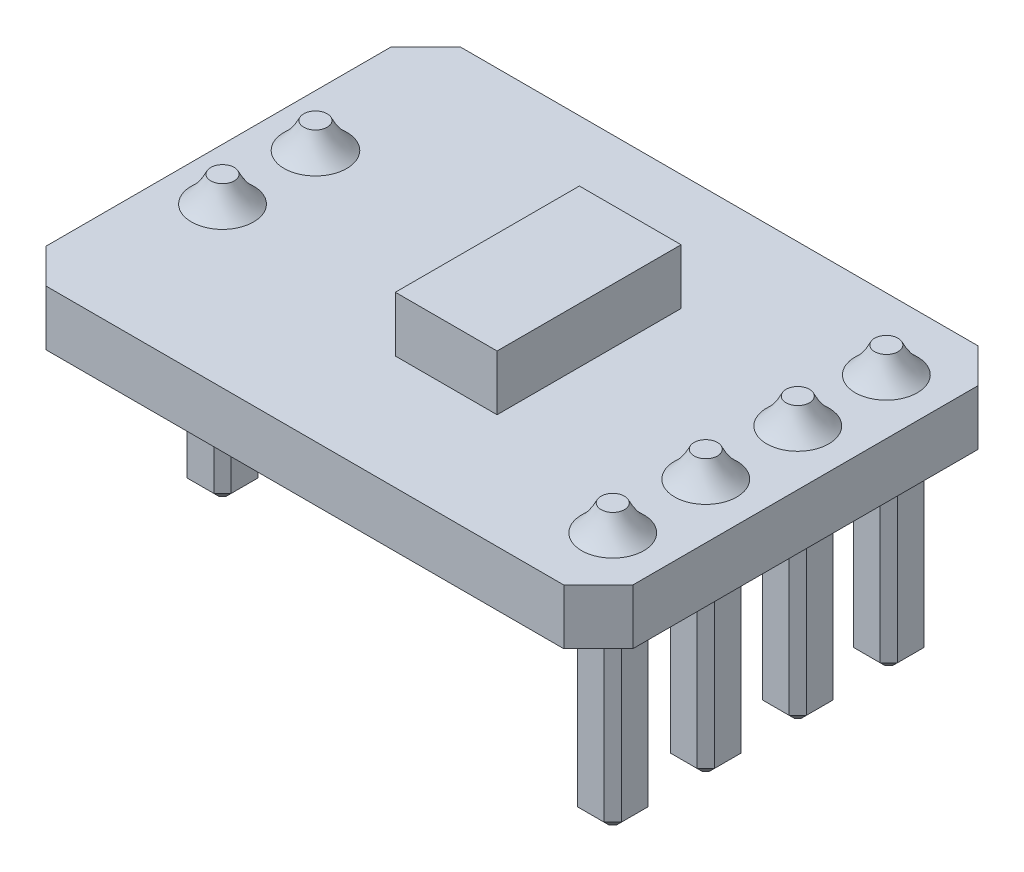
from build123d import *

# Parameters (mm, degrees)
SKETCH1_W           = 17
SKETCH1_H           = 12
BOSS_EXTRUDE1_DEPTH = 1.6
SKETCH3_W           = 2.946551977
SKETCH3_H           = 5.331132701
BOSS_EXTRUDE2_DEPTH = 1.6
SKETCH10_W          = 1.272792206
SKETCH10_H          = 1.272792206
SKETCH10_H_2        = 1.272792207
BOSS_EXTRUDE3_DEPTH = 7
CHAMFER1_SIZE       = 0.25
SKETCH14_W          = 1.28426818
SKETCH14_H          = 1.28426818
SKETCH14_W_2        = 1.272792206
SKETCH14_H_2        = 1.272792206
BOSS_EXTRUDE4_DEPTH = 7
CHAMFER3_SIZE       = 0.25
FILLET1_R           = 0.1
CHAMFER4_SIZE       = 0.25
CHAMFER5_SIZE       = 1


with BuildPart() as part:
    # Sketch1 → Boss-Extrude1 (new body)
    with BuildSketch(Plane(origin=(0, 0, 0), x_dir=(1, 0, 0), z_dir=(0, 1, 0))):
        with Locations((8.5, 6)):
            Rectangle(SKETCH1_W, SKETCH1_H)
    extrude(amount=BOSS_EXTRUDE1_DEPTH)

    # Sketch3 → Boss-Extrude2 (add)
    with BuildSketch(Plane(origin=(0, 1.6, 0), x_dir=(1, 0, 0), z_dir=(0, 1, 0))):
        with Locations((9.289797438, 5.969623176)):
            Rectangle(SKETCH3_W, SKETCH3_H)
    extrude(amount=BOSS_EXTRUDE2_DEPTH)

    # Sketch5 → Revolve1 (revolve)
    with BuildSketch(Plane(origin=(15.4, 0, 0), x_dir=(0, 0, -1), z_dir=(1, 0, 0)), mode=Mode.PRIVATE) as revolve1_sk:
        with BuildLine():
            Line((2.018773021, 2.35), (2.357565231, 2.35))
            ThreePointArc((2.357565231, 2.35), (2.59682711, 1.944064718), (2.918773021, 1.6))
            Line((2.918773021, 1.6), (2.018773021, 1.6))
            Line((2.018773021, 1.6), (2.018773021, 2.35))
        make_face()
    revolve(revolve1_sk.sketch.rotate(Axis((15.4, 2.35, -2.018773021), (0, -1, 0)), 180), axis=Axis((15.4, 2.35, -2.018773021), (0, -1, 0)))

    # Sketch9 → Revolve4 (revolve)
    with BuildSketch(Plane(origin=(15.4, 0, 0), x_dir=(0, 0, -1), z_dir=(1, 0, 0)), mode=Mode.PRIVATE) as revolve4_sk:
        with BuildLine():
            Line((7.717859188, 2.35), (7.379066978, 2.35))
            Line((7.379066978, 2.35), (7.379066978, 1.6))
            Line((7.379066978, 1.6), (8.279066978, 1.6))
            ThreePointArc((8.279066978, 1.6), (7.957121066, 1.944064718), (7.717859188, 2.35))
        make_face()
    revolve(revolve4_sk.sketch.rotate(Axis((15.4, 1.6, -7.379066978), (0, -1, 0)), 180), axis=Axis((15.4, 1.6, -7.379066978), (0, -1, 0)))



with BuildPart() as body_2:
    # Sketch7 → Revolve3 (revolve)
    with BuildSketch(Plane(origin=(15.4, 0, 0), x_dir=(0, 0, -1), z_dir=(1, 0, 0)), mode=Mode.PRIVATE) as revolve3_sk:
        with BuildLine():
            Line((5.05205667, 2.35), (4.713264461, 2.35))
            Line((4.713264461, 2.35), (4.713264461, 1.6))
            Line((4.713264461, 1.6), (5.613264461, 1.6))
            ThreePointArc((5.613264461, 1.6), (5.291318549, 1.944064718), (5.05205667, 2.35))
        make_face()
    revolve(revolve3_sk.sketch.rotate(Axis((15.4, 1.6, -4.713264461), (0, -1, 0)), 180), axis=Axis((15.4, 1.6, -4.713264461), (0, -1, 0)))


with BuildPart() as part_1:
    add(part.part)

    add(body_2.part)  # Boss-Extrude3 merges body 2
    # Sketch10 → Boss-Extrude3 (add)
    with BuildSketch(Plane(origin=(0, 1.6, 0), x_dir=(1, 0, 0), z_dir=(0, 1, 0))):
        with Locations((15.4, 4.713264461)):
            Rectangle(SKETCH10_W, SKETCH10_H)
        with Locations((15.4, 2.018773021)):
            Rectangle(SKETCH10_W, SKETCH10_H_2)
        with Locations((15.4, 7.379066978)):
            Rectangle(SKETCH10_W, SKETCH10_H)
        with Locations((15.4, 10.015994476)):
            Rectangle(SKETCH10_W, SKETCH10_H)
    extrude(amount=-BOSS_EXTRUDE3_DEPTH)

    # Sketch11 → Revolve5 (revolve)
    with BuildSketch(Plane(origin=(15.4, 0, 0), x_dir=(0, 0, -1), z_dir=(1, 0, 0)), mode=Mode.PRIVATE) as revolve5_sk:
        with BuildLine():
            Line((10.283162216, 2.35), (9.944370006, 2.35))
            Line((9.944370006, 2.35), (9.944370006, 1.6))
            Line((9.944370006, 1.6), (10.844370006, 1.6))
            ThreePointArc((10.844370006, 1.6), (10.522424095, 1.944064718), (10.283162216, 2.35))
        make_face()
    revolve(revolve5_sk.sketch.rotate(Axis((15.4, 2.571627195, -9.944370006), (0, -1, 0)), 180), axis=Axis((15.4, 2.571627195, -9.944370006), (0, -1, 0)))

    # Chamfer1
    chamfer1_edges = [part_1.edges().sort_by_distance(p)[0] for p in [
        (16.036396103, -2.7, -5.349660564),
        (16.036396103, -2.7, -4.076868358),
        (14.763603897, -2.7, -4.076868358),
        (14.763603897, -2.7, -5.349660564),
        (16.036396103, -2.7, -2.655169125),
        (16.036396103, -2.7, -1.382376918),
        (14.763603897, -2.7, -1.382376918),
        (14.763603897, -2.7, -2.655169125),
        (16.036396103, -2.7, -8.015463081),
        (16.036396103, -2.7, -6.742670875),
        (14.763603897, -2.7, -6.742670875),
        (14.763603897, -2.7, -8.015463081),
        (16.036396103, -2.7, -10.652390579),
        (16.036396103, -2.7, -9.379598373),
        (14.763603897, -2.7, -9.379598373),
        (14.763603897, -2.7, -10.652390579),
    ]]
    chamfer(chamfer1_edges, length=CHAMFER1_SIZE)

    # Sketch12 → Revolve6 (revolve)
    with BuildSketch(Plane.ZY.offset(-1.5)):
        with BuildLine():
            Line((-6.967592244, 2.35), (-7.306384453, 2.35))
            Line((-7.306384453, 2.35), (-7.306384453, 1.6))
            Line((-7.306384453, 1.6), (-6.398269714, 1.6))
            ThreePointArc((-6.398269714, 1.6), (-6.7244939, 1.943449723), (-6.967592244, 2.35))
        make_face()
    revolve(axis=Axis((1.5, 2.71137522, -7.306384453), (0, -1, 0)))

    # Sketch13 → Revolve7 (revolve)
    with BuildSketch(Plane.ZY.offset(-1.5)):
        with BuildLine():
            Line((-4.274825865, 2.35), (-4.613618075, 2.35))
            Line((-4.613618075, 2.35), (-4.613618075, 1.6))
            Line((-4.613618075, 1.6), (-3.713618075, 1.6))
            ThreePointArc((-3.713618075, 1.6), (-4.035563986, 1.944064718), (-4.274825865, 2.35))
        make_face()
    revolve(axis=Axis((1.5, 2.718876296, -4.613618075), (0, -1, 0)))

    # Sketch14 → Boss-Extrude4 (add)
    with BuildSketch(Plane(origin=(0, 1.6, 0), x_dir=(1, 0, 0), z_dir=(0, 1, 0))):
        with Locations((1.5, 7.306384453)):
            Rectangle(SKETCH14_W, SKETCH14_H)
        with Locations((1.5, 4.613618075)):
            Rectangle(SKETCH14_W_2, SKETCH14_H_2)
    extrude(amount=-BOSS_EXTRUDE4_DEPTH)

    # Chamfer3
    chamfer3_edges = [part_1.edges().sort_by_distance(p)[0] for p in [
        (2.14213409, -2.7, -7.948518543),
        (2.14213409, -2.7, -6.664250363),
        (0.85786591, -2.7, -6.664250363),
        (0.85786591, -2.7, -7.948518543),
        (2.136396103, -2.7, -5.250014178),
        (2.136396103, -2.7, -3.977221972),
        (0.863603897, -2.7, -3.977221972),
        (0.863603897, -2.7, -5.250014178),
    ]]
    chamfer(chamfer3_edges, length=CHAMFER3_SIZE)

    # Fillet1
    fillet1_edges = [part_1.edges().sort_by_distance(p)[0] for p in [
        (15.4, 0, -9.379598373),
        (16.036396103, 0, -10.015994476),
        (14.763603897, 0, -10.015994476),
        (15.4, 0, -10.652390579),
        (15.4, 0, -6.742670875),
        (16.036396103, 0, -7.379066978),
        (14.763603897, 0, -7.379066978),
        (15.4, 0, -8.015463081),
        (14.763603897, 0, -4.713264461),
        (15.4, 0, -4.076868358),
        (15.4, 0, -5.349660564),
        (16.036396103, 0, -4.713264461),
        (15.4, 0, -1.382376918),
        (16.036396103, 0, -2.018773021),
        (14.763603897, 0, -2.018773021),
        (15.4, 0, -2.655169125),
        (15.911396103, 0, -9.504598373),
        (14.888603897, 0, -9.504598373),
        (14.888603897, 0, -10.527390579),
        (15.911396103, 0, -10.527390579),
        (15.911396103, 0, -6.867670875),
        (14.888603897, 0, -6.867670875),
        (14.888603897, 0, -7.890463081),
        (15.911396103, 0, -7.890463081),
        (14.888603897, 0, -4.201868358),
        (14.888603897, 0, -5.224660564),
        (15.911396103, 0, -4.201868358),
        (15.911396103, 0, -5.224660564),
        (15.911396103, 0, -1.507376918),
        (14.888603897, 0, -1.507376918),
        (14.888603897, 0, -2.530169125),
        (15.911396103, 0, -2.530169125),
        (0.85786591, 0, -7.306384453),
        (1.5, 0, -6.664250363),
        (1.5, 0, -7.948518543),
        (2.14213409, 0, -7.306384453),
        (0.863603897, 0, -4.613618075),
        (1.5, 0, -3.977221972),
        (1.5, 0, -5.250014178),
        (2.136396103, 0, -4.613618075),
        (0.98286591, 0, -6.789250363),
        (0.98286591, 0, -7.823518543),
        (2.01713409, 0, -7.823518543),
        (2.01713409, 0, -6.789250363),
        (0.988603897, 0, -4.102221972),
        (0.988603897, 0, -5.125014178),
        (2.011396103, 0, -5.125014178),
        (2.011396103, 0, -4.102221972),
    ]]
    fillet(fillet1_edges, radius=FILLET1_R)

    # Chamfer4
    chamfer4_edges = [part_1.edges().sort_by_distance(p)[0] for p in [
        (15.4, -5.4, -9.379598373),
        (16.036396103, -5.4, -10.015994476),
        (14.763603897, -5.4, -10.015994476),
        (15.4, -5.4, -10.652390579),
        (15.911396103, -5.4, -10.527390579),
        (14.888603897, -5.4, -10.527390579),
        (14.888603897, -5.4, -9.504598373),
        (15.911396103, -5.4, -9.504598373),
        (15.4, -5.4, -6.742670875),
        (16.036396103, -5.4, -7.379066978),
        (14.763603897, -5.4, -7.379066978),
        (15.4, -5.4, -8.015463081),
        (15.911396103, -5.4, -7.890463081),
        (14.888603897, -5.4, -7.890463081),
        (14.888603897, -5.4, -6.867670875),
        (15.911396103, -5.4, -6.867670875),
        (14.763603897, -5.4, -4.713264461),
        (15.4, -5.4, -4.076868358),
        (16.036396103, -5.4, -4.713264461),
        (15.4, -5.4, -5.349660564),
        (15.911396103, -5.4, -5.224660564),
        (15.911396103, -5.4, -4.201868358),
        (14.888603897, -5.4, -5.224660564),
        (14.888603897, -5.4, -4.201868358),
        (15.4, -5.4, -1.382376918),
        (16.036396103, -5.4, -2.018773021),
        (14.763603897, -5.4, -2.018773021),
        (15.4, -5.4, -2.655169125),
        (15.911396103, -5.4, -2.530169125),
        (14.888603897, -5.4, -2.530169125),
        (14.888603897, -5.4, -1.507376918),
        (15.911396103, -5.4, -1.507376918),
        (0.85786591, -5.4, -7.306384453),
        (1.5, -5.4, -6.664250363),
        (2.14213409, -5.4, -7.306384453),
        (1.5, -5.4, -7.948518543),
        (2.01713409, -5.4, -6.789250363),
        (2.01713409, -5.4, -7.823518543),
        (0.98286591, -5.4, -7.823518543),
        (0.98286591, -5.4, -6.789250363),
        (0.863603897, -5.4, -4.613618075),
        (1.5, -5.4, -3.977221972),
        (2.136396103, -5.4, -4.613618075),
        (1.5, -5.4, -5.250014178),
        (2.011396103, -5.4, -4.102221972),
        (2.011396103, -5.4, -5.125014178),
        (0.988603897, -5.4, -5.125014178),
        (0.988603897, -5.4, -4.102221972),
    ]]
    chamfer(chamfer4_edges, length=CHAMFER4_SIZE)

    # Chamfer5
    chamfer5_edges = [part_1.edges().sort_by_distance(p)[0] for p in [
        (0, 0.8, -12),
        (0, 0.8, 0),
        (17, 0.8, 0),
        (17, 0.8, -12),
    ]]
    chamfer(chamfer5_edges, length=CHAMFER5_SIZE)


solid = part_1.part
